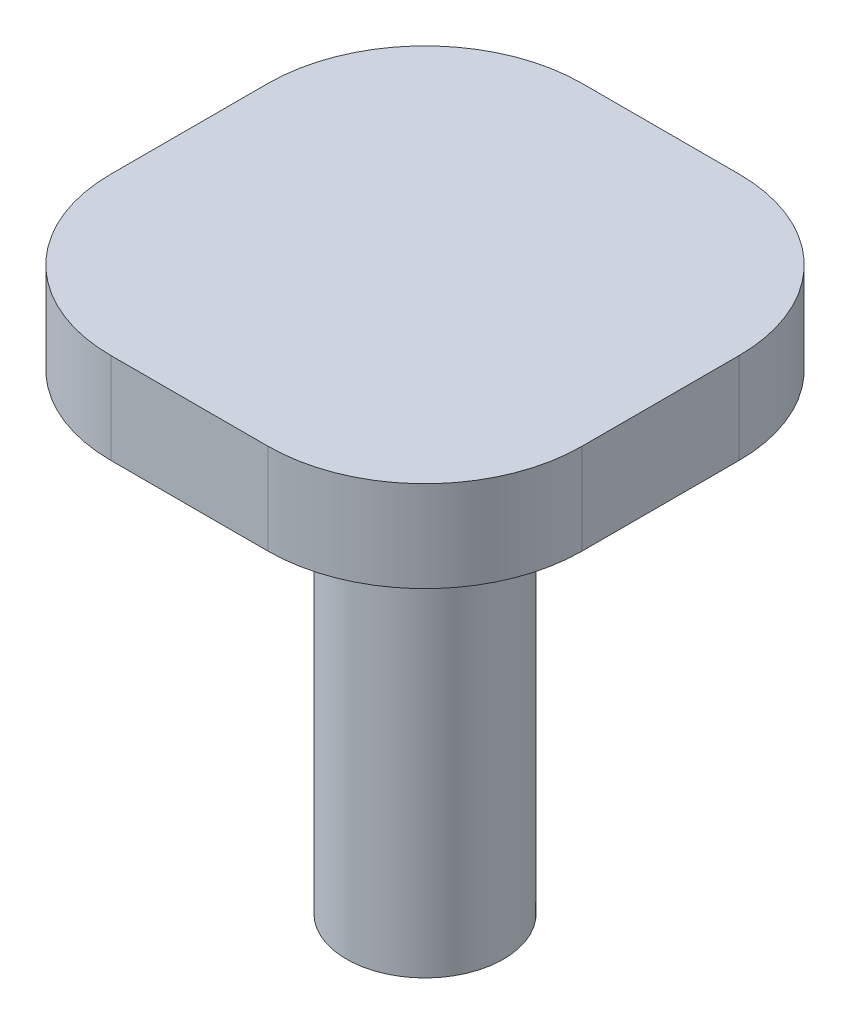
from build123d import *

# Parameters (mm, degrees)
SKETCH1_W                = 1
SKETCH1_H                = 6
BOSS_EXTRUDE1_DEPTH      = 3
BOSS_EXTRUDE1_DEPTH_BACK = 3
SKETCH9_W                = 6
SKETCH9_H                = 1.15698482
FILLET1_R                = 2


with BuildPart() as part:
    # Sketch1 → Revolve3 (revolve)
    with BuildSketch(Plane.XY):
        Rectangle(SKETCH1_W, SKETCH1_H)
    revolve(axis=Axis((-0.5, -3, 0), (0, 1, 0)))

    # Sketch9 → Boss-Extrude1 (add, two sides: drawn at the far end of the back side and taken through both)
    with BuildSketch(Plane.XY.offset(-BOSS_EXTRUDE1_DEPTH_BACK)):
        with Locations((-0.5, 3.57849241)):
            Rectangle(SKETCH9_W, SKETCH9_H)
    extrude(amount=BOSS_EXTRUDE1_DEPTH + BOSS_EXTRUDE1_DEPTH_BACK)

    # Fillet1
    fillet1_edges = [part.edges().sort_by_distance(p)[0] for p in [
        (-3.5, 3.57849241, -3),
        (2.5, 3.57849241, -3),
        (2.5, 3.57849241, 3),
        (-3.5, 3.57849241, 3),
    ]]
    fillet(fillet1_edges, radius=FILLET1_R)


solid = part.part
